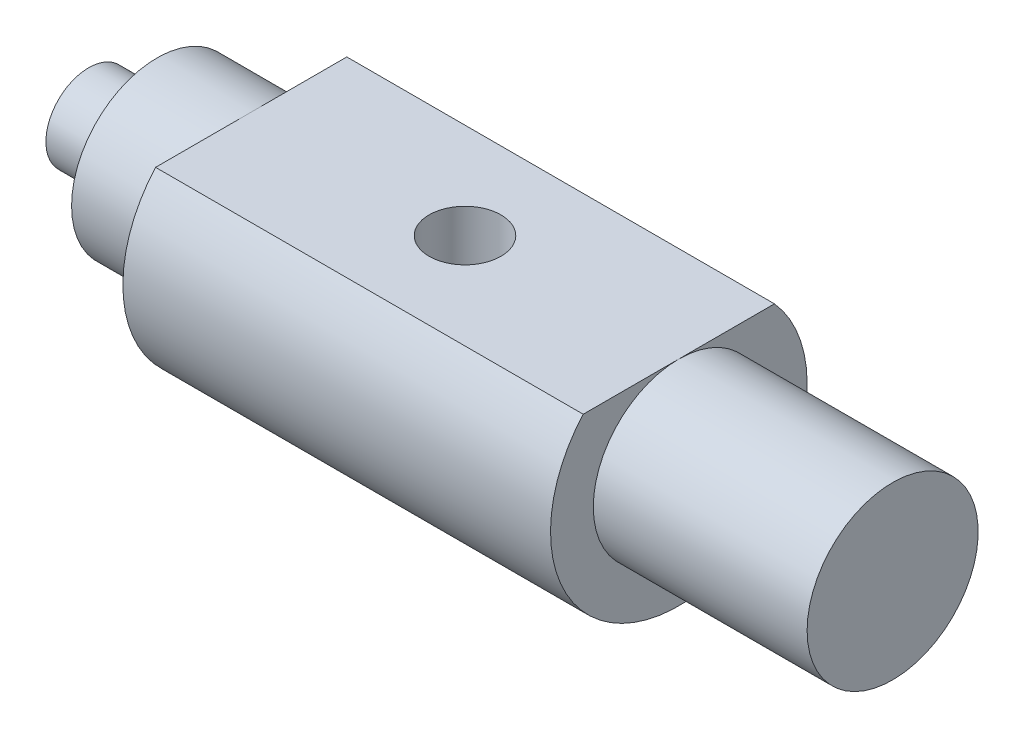
from build123d import *

# Parameters (mm, degrees)
CUT_EXTRUDE_START        = 5
SKETCH_2_W               = 25
SKETCH_2_H               = 23.22226429
CUT_EXTRUDE_1_DEPTH      = 23.156951228
HOLE_WIZARD_M5_1_D       = 4.2
CUT_EXTRUDE_2_DEPTH      = 52.11262078
CUT_EXTRUDE_2_DEPTH_BACK = 7
SKETCH_6_OUTSIDE_W       = 27.736
SKETCH_6_OUTSIDE_H       = 25.236
SKETCH_6_OUTSIDE_R       = 2.5
CUT_EXTRUDE_START_2      = -3
SKETCH_7_R               = 2.5
CUT_EXTRUDE_3_DEPTH      = 3
HOLE_WIZARD_M4_1_D       = 3.3
HOLE_WIZARD_M4_1_DEPTH   = 8
HOLE_WIZARD_M4_1_TIP     = 0.991420021


with BuildPart() as part:
    # 草图1 → 旋转1 (revolve)
    with BuildSketch(Plane.XY, mode=Mode.PRIVATE) as revolve_1_sk:
        Polygon((0, 7.5), (12.5, 7.5), (12.5, 5), (25, 5), (25, 0), (0, 0), align=None)
    revolve_1 = revolve(revolve_1_sk.sketch.rotate(Axis((0, 0, 0), (1, 0, 0)), 90), axis=Axis((0, 0, 0), (1, 0, 0)))

    # 镜向1: 旋转1 across plane
    add(revolve_1.mirror(Plane(origin=(0, 0, 0), x_dir=(0, 0, 1), z_dir=(1, 0, 0))))

    # 草图2 → 切除-拉伸1 (cut, through all)
    with BuildSketch(Plane(origin=(0, 0, 0), x_dir=(1, 0, 0), z_dir=(0, 1, 0)).offset(CUT_EXTRUDE_START)):
        Rectangle(SKETCH_2_W, SKETCH_2_H)
    extrude(amount=CUT_EXTRUDE_1_DEPTH, mode=Mode.SUBTRACT)

    # M5 螺纹孔的螺纹孔钻头1 (through all)
    with Locations(Plane(origin=(0, 5, 0), x_dir=(1, 0, 0), z_dir=(0, 1, 0))):
        with Locations((0, 0)):
            Hole(HOLE_WIZARD_M5_1_D / 2)

    # 草图6 outside → 切除-拉伸2 (cut, two sides: drawn at the far end of the back side and taken through both)
    with BuildSketch(Plane.ZY.offset(25).offset(-CUT_EXTRUDE_2_DEPTH_BACK)):
        with Locations((0, -1.25)):
            Rectangle(SKETCH_6_OUTSIDE_W, SKETCH_6_OUTSIDE_H)
        with Locations(Location((0, 0, 0), (0, 0, 180))):
            Circle(SKETCH_6_OUTSIDE_R, mode=Mode.SUBTRACT)
    extrude(amount=CUT_EXTRUDE_2_DEPTH + CUT_EXTRUDE_2_DEPTH_BACK, mode=Mode.SUBTRACT)

    # 草图7 → 切除-拉伸3 (cut)
    with BuildSketch(Plane.ZY.offset(25).offset(CUT_EXTRUDE_START_2)):
        with Locations(Location((0, 0, 0), (0, 0, 180))):
            Circle(SKETCH_7_R)
    extrude(amount=CUT_EXTRUDE_3_DEPTH, mode=Mode.SUBTRACT)

    # M4 螺纹孔的螺纹孔钻头1
    with Locations(Plane.ZY.offset(22)):
        with Locations((0, 0)):
            Hole(HOLE_WIZARD_M4_1_D / 2, depth=HOLE_WIZARD_M4_1_DEPTH)
            with Locations((0, 0, -(HOLE_WIZARD_M4_1_DEPTH + HOLE_WIZARD_M4_1_TIP / 2))):  # 118° drill point
                Cone(0, HOLE_WIZARD_M4_1_D / 2, HOLE_WIZARD_M4_1_TIP, mode=Mode.SUBTRACT)


solid = part.part
